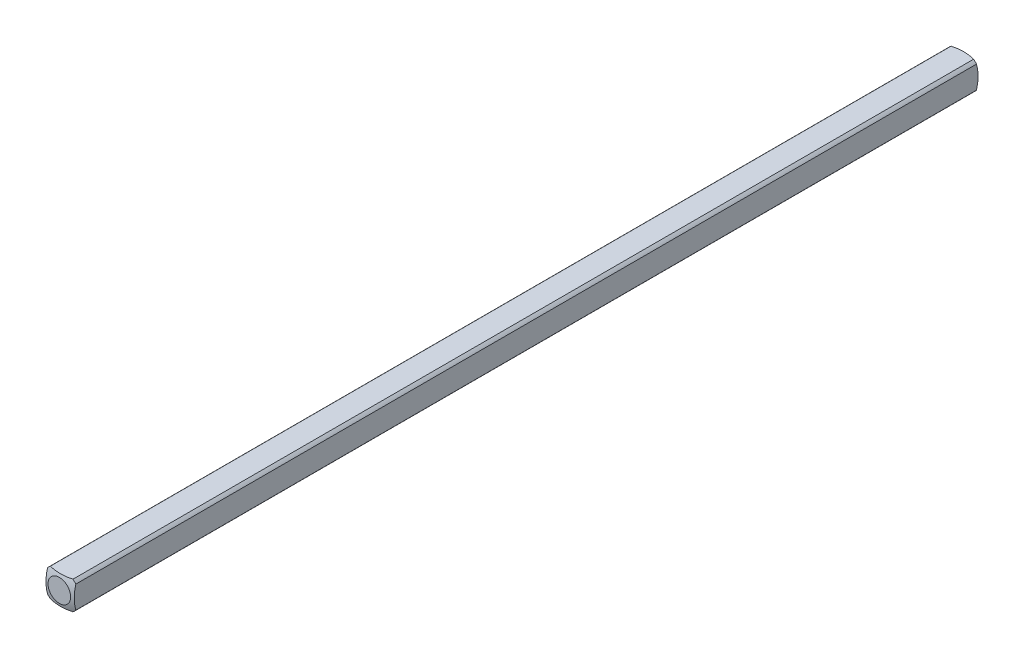
from build123d import *

# Parameters (mm, degrees)
SKETCH1_W           = 3.175
SKETCH1_H           = 3.175
BOSS_EXTRUDE1_DEPTH = 50.8
SKETCH2_OUTSIDE_W   = 15.376
SKETCH2_OUTSIDE_H   = 15.375
SKETCH2_OUTSIDE_R   = 2.032
CUT_EXTRUDE1_DEPTH  = 51.849585175


with BuildPart() as part:
    # Sketch1 → Boss-Extrude1 (new body)
    with BuildSketch(Plane.XY):
        Rectangle(SKETCH1_W, SKETCH1_H)
    extrude(amount=BOSS_EXTRUDE1_DEPTH)

    # Sketch2 outside → Cut-Extrude1 (cut, through all)
    with BuildSketch(Plane(origin=(0, 0, 0), x_dir=(-1, 0, 0), z_dir=(0, 0, -1))):
        with Locations((0, -0.0005)):
            Rectangle(SKETCH2_OUTSIDE_W, SKETCH2_OUTSIDE_H)
        Circle(SKETCH2_OUTSIDE_R, mode=Mode.SUBTRACT)
    extrude(amount=-CUT_EXTRUDE1_DEPTH, mode=Mode.SUBTRACT)

    # Sketch3 → Cut-Revolve1 (revolve, cut)
    with BuildSketch(Plane(origin=(0, 0, 0), x_dir=(1, 0, 0), z_dir=(0, 1, 0))):
        with BuildLine():
            Line((-5.053685963, -4.40273269), (-5.053685963, 5.740530545))
            Line((-5.053685963, 5.740530545), (0, 5.740530545))
            Line((0, 5.740530545), (0, 0.160877736))
            ThreePointArc((0, 0.160877736), (-3.404639553, -1.148866368), (-5.053685963, -4.40273269))
        make_face()
    revolve(axis=Axis((0, 0, 50.8), (0, 0, -1)), mode=Mode.SUBTRACT)

    # Mirror1: part across plane


with BuildPart() as part_1:
    add(part.part)
    add(part.part.mirror(Plane(origin=(0, 0, 50.8), x_dir=(1, 0, 0), z_dir=(0, 0, -1))))


solid = part_1.part
